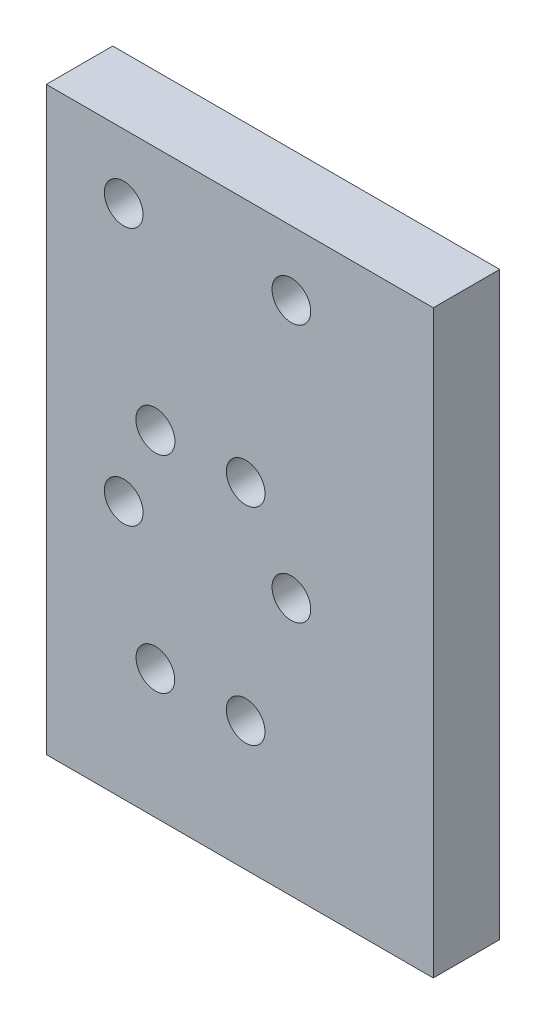
from build123d import *

# Parameters (mm, degrees)
SKETCH_1_W               = 30
SKETCH_1_H               = 45
EXTRUDE_1_DEPTH          = 5.15
CUT_EXTRUDE_1_DEPTH      = 59.428802829
CUT_EXTRUDE_1_DEPTH_BACK = 59.428802829
SKETCH_2_R               = 1.5
CUT_EXTRUDE_2_DEPTH      = 59.428802829
CUT_EXTRUDE_2_DEPTH_BACK = 59.428802829
SKETCH_3_R               = 1.5
SKETCH_3_R_2             = 1.513831086


with BuildPart() as part:
    # 草图1 → 凸台-拉伸1 (new body)
    with BuildSketch(Plane.XY):
        with Locations((-38, -1.55)):
            Rectangle(SKETCH_1_W, SKETCH_1_H)
    extrude(amount=EXTRUDE_1_DEPTH)

    # 草图2 → 切除-拉伸1 (cut, two sides: drawn at the far end of the back side and taken through both)
    with BuildSketch(Plane.XY.offset(5.15).offset(-CUT_EXTRUDE_1_DEPTH_BACK)):
        with Locations((-34, 15.95)):
            Circle(SKETCH_2_R)
        with Locations((-47, 15.95)):
            Circle(SKETCH_2_R)
        with Locations((-34, -4.05)):
            Circle(SKETCH_2_R)
        with Locations((-47, -4.05)):
            Circle(SKETCH_2_R)
    extrude(amount=CUT_EXTRUDE_1_DEPTH + CUT_EXTRUDE_1_DEPTH_BACK, mode=Mode.SUBTRACT)

    # 草图3 → 切除-拉伸2 (cut, two sides: drawn at the far end of the back side and taken through both)
    with BuildSketch(Plane.XY.offset(5.15).offset(-CUT_EXTRUDE_2_DEPTH_BACK)):
        with Locations((-44.544155877, -14.05)):
            Circle(SKETCH_3_R)
        with Locations((-37.544155877, -14.05)):
            Circle(SKETCH_3_R)
        with Locations((-44.544155877, 1.95)):
            Circle(SKETCH_3_R_2)
        with Locations((-37.544155877, 1.95)):
            Circle(SKETCH_3_R)
    extrude(amount=CUT_EXTRUDE_2_DEPTH + CUT_EXTRUDE_2_DEPTH_BACK, mode=Mode.SUBTRACT)


solid = part.part
